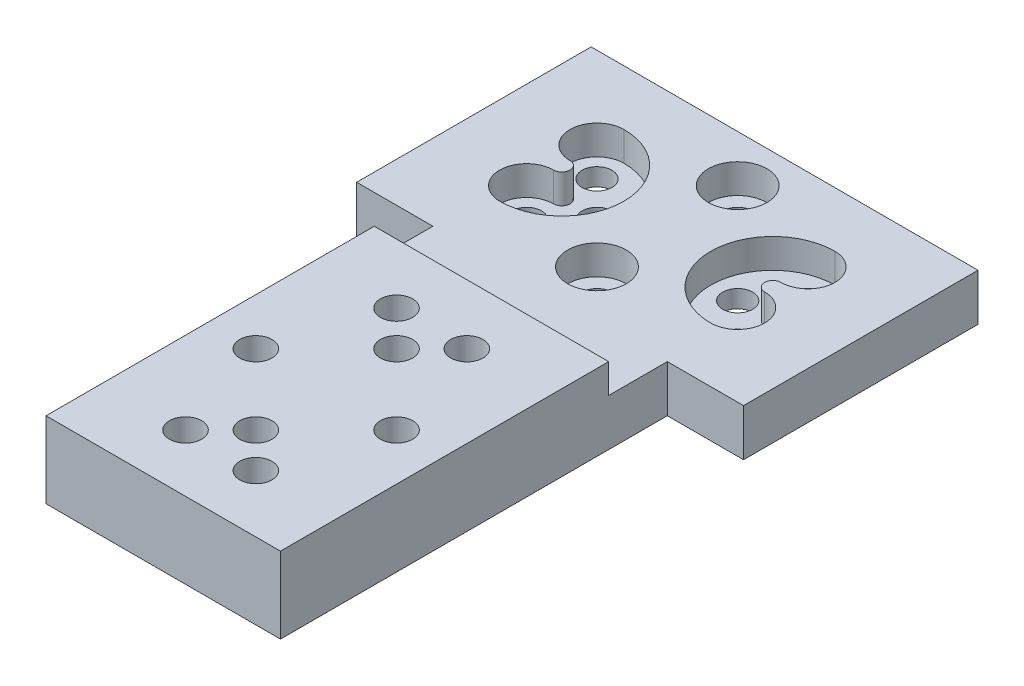
from build123d import *

# Parameters (mm, degrees)
BOSS_EXTRUDE1_DEPTH = 4
SKETCH2_W           = 20
SKETCH2_H           = 28
BOSS_EXTRUDE2_DEPTH = 2.5
CUT_EXTRUDE1_REACH  = 61.611
SKETCH3_R           = 1.375
SKETCH3_R_2         = 1.275
SKETCH4_R           = 2.5
CUT_EXTRUDE2_DEPTH  = 1.5
SKETCH5_R           = 2.5
CUT_EXTRUDE3_DEPTH  = 2.5


with BuildPart() as part:
    # Sketch1 → Boss-Extrude1 (new body)
    with BuildSketch(Plane(origin=(0, 0, 0), x_dir=(1, 0, 0), z_dir=(0, 1, 0))):
        Polygon((0, 0), (20, 0), (20, 33), (26.5, 33), (26.5, 53), (-6.5, 53), (-6.5, 33), (0, 33), align=None)
    extrude(amount=BOSS_EXTRUDE1_DEPTH)

    # Sketch2 → Boss-Extrude2 (add)
    with BuildSketch(Plane(origin=(0, 4, 0), x_dir=(1, 0, 0), z_dir=(0, 1, 0))):
        with Locations((10, 14)):
            Rectangle(SKETCH2_W, SKETCH2_H)
    extrude(amount=BOSS_EXTRUDE2_DEPTH)

    # Sketch3 → Cut-Extrude1 (cut, up to next)
    with BuildSketch(Plane.XZ, mode=Mode.PRIVATE) as cut_extrude1_sk1:
        with Locations(Location((10, -7.9, 0), (0, 0, 270))):
            Circle(SKETCH3_R)
    cut_extrude1_tool1 = extrude(cut_extrude1_sk1.sketch, amount=-CUT_EXTRUDE1_REACH, mode=Mode.PRIVATE) & part.part
    # Sketch3 → Cut-Extrude1 (cut, up to next)
    with BuildSketch(Plane.XZ, mode=Mode.PRIVATE) as cut_extrude1_sk2:
        with Locations(Location((7, -4.9, 0), (0, 0, 270))):
            Circle(SKETCH3_R)
    cut_extrude1_tool2 = extrude(cut_extrude1_sk2.sketch, amount=-CUT_EXTRUDE1_REACH, mode=Mode.PRIVATE) & part.part
    # Sketch3 → Cut-Extrude1 (cut, up to next)
    with BuildSketch(Plane.XZ, mode=Mode.PRIVATE) as cut_extrude1_sk3:
        with Locations(Location((4, -13.9, 0), (0, 0, 270))):
            Circle(SKETCH3_R)
    cut_extrude1_tool3 = extrude(cut_extrude1_sk3.sketch, amount=-CUT_EXTRUDE1_REACH, mode=Mode.PRIVATE) & part.part
    # Sketch3 → Cut-Extrude1 (cut, up to next)
    with BuildSketch(Plane.XZ, mode=Mode.PRIVATE) as cut_extrude1_sk4:
        with Locations(Location((10, -19.9, 0), (0, 0, 270))):
            Circle(SKETCH3_R)
    cut_extrude1_tool4 = extrude(cut_extrude1_sk4.sketch, amount=-CUT_EXTRUDE1_REACH, mode=Mode.PRIVATE) & part.part
    # Sketch3 → Cut-Extrude1 (cut, up to next)
    with BuildSketch(Plane.XZ, mode=Mode.PRIVATE) as cut_extrude1_sk5:
        with Locations(Location((7, -22.9, 0), (0, 0, 270))):
            Circle(SKETCH3_R)
    cut_extrude1_tool5 = extrude(cut_extrude1_sk5.sketch, amount=-CUT_EXTRUDE1_REACH, mode=Mode.PRIVATE) & part.part
    # Sketch3 → Cut-Extrude1 (cut, up to next)
    with BuildSketch(Plane.XZ, mode=Mode.PRIVATE) as cut_extrude1_sk6:
        with Locations(Location((13, -4.9, 0), (0, 0, 270))):
            Circle(SKETCH3_R)
    cut_extrude1_tool6 = extrude(cut_extrude1_sk6.sketch, amount=-CUT_EXTRUDE1_REACH, mode=Mode.PRIVATE) & part.part
    # Sketch3 → Cut-Extrude1 (cut, up to next)
    with BuildSketch(Plane.XZ, mode=Mode.PRIVATE) as cut_extrude1_sk7:
        with Locations(Location((13, -22.9, 0), (0, 0, 270))):
            Circle(SKETCH3_R)
    cut_extrude1_tool7 = extrude(cut_extrude1_sk7.sketch, amount=-CUT_EXTRUDE1_REACH, mode=Mode.PRIVATE) & part.part
    # Sketch3 → Cut-Extrude1 (cut, up to next)
    with BuildSketch(Plane.XZ, mode=Mode.PRIVATE) as cut_extrude1_sk8:
        with Locations(Location((16, -13.9, 0), (0, 0, 270))):
            Circle(SKETCH3_R)
    cut_extrude1_tool8 = extrude(cut_extrude1_sk8.sketch, amount=-CUT_EXTRUDE1_REACH, mode=Mode.PRIVATE) & part.part
    # Sketch3 → Cut-Extrude1 (cut, up to next)
    with BuildSketch(Plane.XZ, mode=Mode.PRIVATE) as cut_extrude1_sk9:
        with Locations(Location((10, -49, 0), (0, 0, 270))):
            Circle(SKETCH3_R_2)
    cut_extrude1_tool9 = extrude(cut_extrude1_sk9.sketch, amount=-CUT_EXTRUDE1_REACH, mode=Mode.PRIVATE) & part.part
    # Sketch3 → Cut-Extrude1 (cut, up to next)
    with BuildSketch(Plane.XZ, mode=Mode.PRIVATE) as cut_extrude1_sk10:
        with Locations(Location((4, -43, 0), (0, 0, 270))):
            Circle(SKETCH3_R_2)
    cut_extrude1_tool10 = extrude(cut_extrude1_sk10.sketch, amount=-CUT_EXTRUDE1_REACH, mode=Mode.PRIVATE) & part.part
    # Sketch3 → Cut-Extrude1 (cut, up to next)
    with BuildSketch(Plane.XZ, mode=Mode.PRIVATE) as cut_extrude1_sk11:
        with Locations(Location((1, -46, 0), (0, 0, 270))):
            Circle(SKETCH3_R_2)
    cut_extrude1_tool11 = extrude(cut_extrude1_sk11.sketch, amount=-CUT_EXTRUDE1_REACH, mode=Mode.PRIVATE) & part.part
    # Sketch3 → Cut-Extrude1 (cut, up to next)
    with BuildSketch(Plane.XZ, mode=Mode.PRIVATE) as cut_extrude1_sk12:
        with Locations(Location((10, -37, 0), (0, 0, 90))):
            Circle(SKETCH3_R_2)
    cut_extrude1_tool12 = extrude(cut_extrude1_sk12.sketch, amount=-CUT_EXTRUDE1_REACH, mode=Mode.PRIVATE) & part.part
    # Sketch3 → Cut-Extrude1 (cut, up to next)
    with BuildSketch(Plane.XZ, mode=Mode.PRIVATE) as cut_extrude1_sk13:
        with Locations(Location((1, -40, 0), (0, 0, 90))):
            Circle(SKETCH3_R_2)
    cut_extrude1_tool13 = extrude(cut_extrude1_sk13.sketch, amount=-CUT_EXTRUDE1_REACH, mode=Mode.PRIVATE) & part.part
    # Sketch3 → Cut-Extrude1 (cut, up to next)
    with BuildSketch(Plane.XZ, mode=Mode.PRIVATE) as cut_extrude1_sk14:
        with Locations(Location((19, -46, 0), (0, 0, 90))):
            Circle(SKETCH3_R_2)
    cut_extrude1_tool14 = extrude(cut_extrude1_sk14.sketch, amount=-CUT_EXTRUDE1_REACH, mode=Mode.PRIVATE) & part.part
    # Sketch3 → Cut-Extrude1 (cut, up to next)
    with BuildSketch(Plane.XZ, mode=Mode.PRIVATE) as cut_extrude1_sk15:
        with Locations(Location((16, -43, 0), (0, 0, 90))):
            Circle(SKETCH3_R_2)
    cut_extrude1_tool15 = extrude(cut_extrude1_sk15.sketch, amount=-CUT_EXTRUDE1_REACH, mode=Mode.PRIVATE) & part.part
    # Sketch3 → Cut-Extrude1 (cut, up to next)
    with BuildSketch(Plane.XZ, mode=Mode.PRIVATE) as cut_extrude1_sk16:
        with Locations(Location((19, -40, 0), (0, 0, 270))):
            Circle(SKETCH3_R_2)
    cut_extrude1_tool16 = extrude(cut_extrude1_sk16.sketch, amount=-CUT_EXTRUDE1_REACH, mode=Mode.PRIVATE) & part.part
    add(cut_extrude1_tool1.solids().sort_by_distance((10, 0, -7.9))[0], mode=Mode.SUBTRACT)
    add(cut_extrude1_tool2.solids().sort_by_distance((7, 0, -4.9))[0], mode=Mode.SUBTRACT)
    add(cut_extrude1_tool3.solids().sort_by_distance((4, 0, -13.9))[0], mode=Mode.SUBTRACT)
    add(cut_extrude1_tool4.solids().sort_by_distance((10, 0, -19.9))[0], mode=Mode.SUBTRACT)
    add(cut_extrude1_tool5.solids().sort_by_distance((7, 0, -22.9))[0], mode=Mode.SUBTRACT)
    add(cut_extrude1_tool6.solids().sort_by_distance((13, 0, -4.9))[0], mode=Mode.SUBTRACT)
    add(cut_extrude1_tool7.solids().sort_by_distance((13, 0, -22.9))[0], mode=Mode.SUBTRACT)
    add(cut_extrude1_tool8.solids().sort_by_distance((16, 0, -13.9))[0], mode=Mode.SUBTRACT)
    add(cut_extrude1_tool9.solids().sort_by_distance((10, 0, -49))[0], mode=Mode.SUBTRACT)
    add(cut_extrude1_tool10.solids().sort_by_distance((4, 0, -43))[0], mode=Mode.SUBTRACT)
    add(cut_extrude1_tool11.solids().sort_by_distance((1, 0, -46))[0], mode=Mode.SUBTRACT)
    add(cut_extrude1_tool12.solids().sort_by_distance((10, 0, -37))[0], mode=Mode.SUBTRACT)
    add(cut_extrude1_tool13.solids().sort_by_distance((1, 0, -40))[0], mode=Mode.SUBTRACT)
    add(cut_extrude1_tool14.solids().sort_by_distance((19, 0, -46))[0], mode=Mode.SUBTRACT)
    add(cut_extrude1_tool15.solids().sort_by_distance((16, 0, -43))[0], mode=Mode.SUBTRACT)
    add(cut_extrude1_tool16.solids().sort_by_distance((19, 0, -40))[0], mode=Mode.SUBTRACT)

    # Sketch4 → Cut-Extrude2 (cut)
    with BuildSketch(Plane.XZ):
        with Locations(Location((4, -13.9, 0), (0, 0, 270))):
            Circle(SKETCH4_R)
        with Locations(Location((16, -13.9, 0), (0, 0, 270))):
            Circle(SKETCH4_R)
        with BuildLine():
            ThreePointArc((15.5, -22.9), (10, -17.4), (4.5, -22.9))
            ThreePointArc((4.5, -22.9), (7, -25.4), (9.5, -22.9))
            ThreePointArc((9.5, -22.9), (10, -22.4), (10.5, -22.9))
            ThreePointArc((10.5, -22.9), (13, -25.4), (15.5, -22.9))
        make_face()
        with BuildLine():
            ThreePointArc((15.5, -4.9), (10, -10.4), (4.5, -4.9))
            ThreePointArc((4.5, -4.9), (7, -2.4), (9.5, -4.9))
            ThreePointArc((9.5, -4.9), (10, -5.4), (10.5, -4.9))
            ThreePointArc((10.5, -4.9), (13, -2.4), (15.5, -4.9))
        make_face()
    extrude(amount=-CUT_EXTRUDE2_DEPTH, mode=Mode.SUBTRACT)

    # Sketch5 → Cut-Extrude3 (cut)
    with BuildSketch(Plane(origin=(0, 4, 0), x_dir=(1, 0, 0), z_dir=(0, 1, 0))):
        with Locations(Location((10, 49, 0), (0, 0, 270))):
            Circle(SKETCH5_R)
        with Locations(Location((10, 37, 0), (0, 0, 270))):
            Circle(SKETCH5_R)
        with BuildLine():
            ThreePointArc((19, 48.3), (13.7, 43), (19, 37.7))
            ThreePointArc((19, 37.7), (21.3, 40), (19, 42.3))
            ThreePointArc((19, 42.3), (18.3, 43), (19, 43.7))
            ThreePointArc((19, 43.7), (21.3, 46), (19, 48.3))
        make_face()
        with BuildLine():
            ThreePointArc((1, 48.3), (6.3, 43), (1, 37.7))
            ThreePointArc((1, 37.7), (-1.3, 40), (1, 42.3))
            ThreePointArc((1, 42.3), (1.7, 43), (1, 43.7))
            ThreePointArc((1, 43.7), (-1.3, 46), (1, 48.3))
        make_face()
    extrude(amount=-CUT_EXTRUDE3_DEPTH, mode=Mode.SUBTRACT)


solid = part.part
